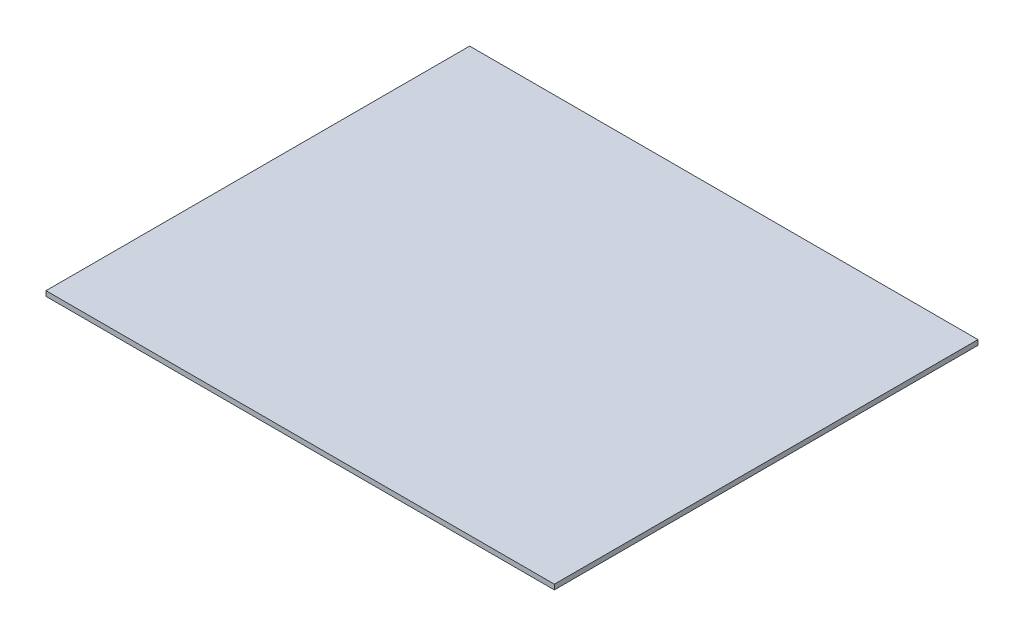
from build123d import *

# Parameters (mm, degrees)
SKETCH1_W           = 102
SKETCH1_H           = 85
BOSS_EXTRUDE1_DEPTH = 0.5


with BuildPart() as part:
    # Sketch1 → Boss-Extrude1 (new, symmetric)
    with BuildSketch(Plane(origin=(0, 0, 0), x_dir=(1, 0, 0), z_dir=(0, 1, 0))):
        Rectangle(SKETCH1_W, SKETCH1_H)
    extrude(amount=BOSS_EXTRUDE1_DEPTH, both=True)


solid = part.part
